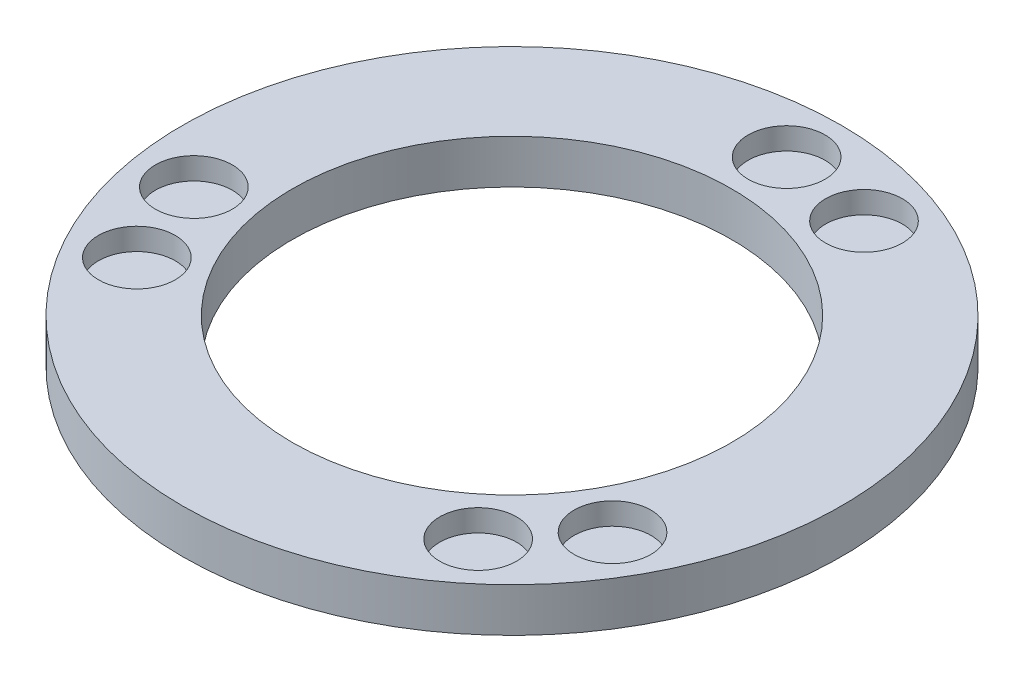
from build123d import *

# Parameters (mm, degrees)
SKETCH1_R          = 150
SKETCH1_R_2        = 100
EXTRUDE1_DEPTH     = 20
SKETCH2_R          = 17.5
CUT_EXTRUDE1_DEPTH = 10


with BuildPart() as part:
    # Sketch1 → Extrude1 (new body)
    with BuildSketch(Plane(origin=(0, 0, 0), x_dir=(1, 0, 0), z_dir=(0, 1, 0))):
        with Locations(Location((0, 0, 0), (0, 0, 270))):
            Circle(SKETCH1_R)
        with Locations(Location((0, 0, 0), (0, 0, 270))):
            Circle(SKETCH1_R_2, mode=Mode.SUBTRACT)
    extrude(amount=-EXTRUDE1_DEPTH)

    # Sketch2 → Cut-Extrude1 (cut)
    with BuildSketch(Plane(origin=(0, 0, 0), x_dir=(1, 0, 0), z_dir=(0, 1, 0))):
        with Locations(Location((0, 125, 0), (0, 0, 270))):
            Circle(SKETCH2_R)
        with Locations(Location((42.752517916, 117.461577598, 0), (0, 0, 270))):
            Circle(SKETCH2_R)
        with Locations(Location((108.253175473, -62.5, 0), (0, 0, 270))):
            Circle(SKETCH2_R)
        with Locations(Location((80.348451211, -95.75555539, 0), (0, 0, 270))):
            Circle(SKETCH2_R)
        with Locations(Location((-108.253175473, -62.5, 0), (0, 0, 270))):
            Circle(SKETCH2_R)
        with Locations(Location((-123.100969127, -21.706022208, 0), (0, 0, 270))):
            Circle(SKETCH2_R)
    extrude(amount=-CUT_EXTRUDE1_DEPTH, mode=Mode.SUBTRACT)


solid = part.part
